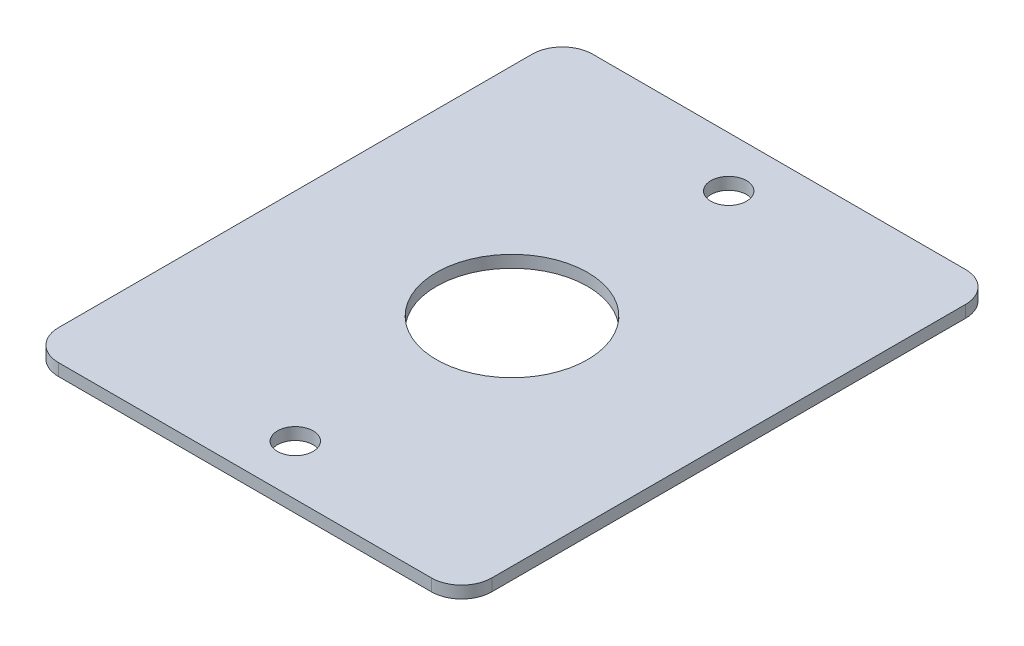
from build123d import *

# Parameters (mm, degrees)
SKETCH1_W           = 54.61
SKETCH1_H           = 67.31
SKETCH1_R           = 9.525
SKETCH1_R_2         = 2.2479
BOSS_EXTRUDE1_DEPTH = 1.524
FILLET1_R           = 3.81


with BuildPart() as part:
    # Sketch1 → Boss-Extrude1 (new body)
    with BuildSketch(Plane(origin=(0, 0, 0), x_dir=(1, 0, 0), z_dir=(0, 1, 0))):
        Rectangle(SKETCH1_W, SKETCH1_H)
        with Locations(Location((0, 0, 0), (0, 0, 90))):
            Circle(SKETCH1_R, mode=Mode.SUBTRACT)
        with Locations(Location((0, 27.305, 0), (0, 0, 90))):
            Circle(SKETCH1_R_2, mode=Mode.SUBTRACT)
        with Locations(Location((0, -27.305, 0), (0, 0, 90))):
            Circle(SKETCH1_R_2, mode=Mode.SUBTRACT)
    extrude(amount=BOSS_EXTRUDE1_DEPTH)

    # Fillet1
    fillet1_edges = [part.edges().sort_by_distance(p)[0] for p in [
        (27.305, 0.762, -33.655),
        (27.305, 0.762, 33.655),
        (-27.305, 0.762, 33.655),
        (-27.305, 0.762, -33.655),
    ]]
    fillet(fillet1_edges, radius=FILLET1_R)


solid = part.part
